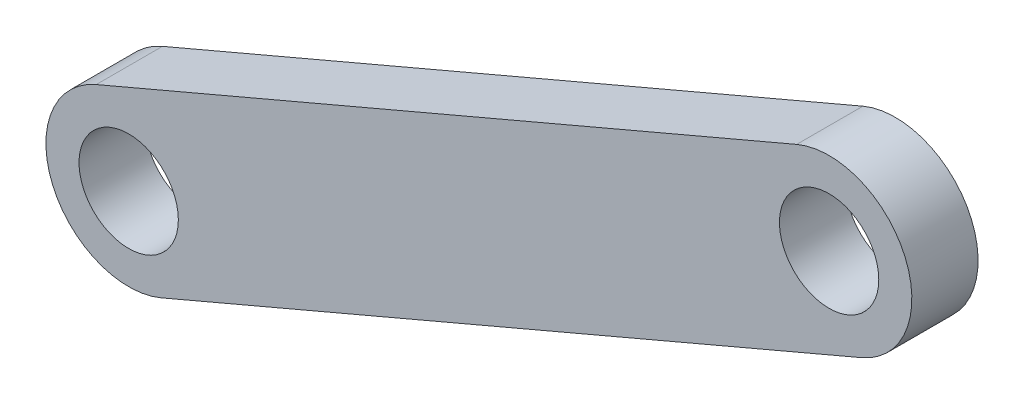
from build123d import *

# Parameters (mm, degrees)
BOSS_EXTRU_1_START      = -4
BOSS_EXTRU_1_DEPTH      = 2
ESQUISSE2_R             = 1.5
ENL_V_MAT_EXTRU_1_DEPTH = 2


with BuildPart() as part:
    # Esquisse1 → Boss.-Extru.1 (new body)
    with BuildSketch(Plane.XY.offset(BOSS_EXTRU_1_START)):
        with BuildLine():
            Line((-20.180030535, -16.314431829), (0.97983118, -7.299984969))
            ThreePointArc((0.97983118, -7.299984969), (2.40785155, -4.327503968), (-0.353745657, -2.52515374))
            ThreePointArc((-0.353745657, -2.52515374), (-0.672496032, -2.59214845), (-0.97983118, -2.700015031))
            Line((-0.97983118, -2.700015031), (-6.059542219, -4.86405494))
            Line((-6.059542219, -4.86405494), (-22.139692896, -11.714461891))
            ThreePointArc((-22.139692896, -11.714461891), (-23.459846684, -14.994278041), (-20.180030535, -16.314431829))
        make_face()
    extrude(amount=BOSS_EXTRU_1_DEPTH)

    # Esquisse2 → Enlèv. mat.-Extru.1 (cut)
    with BuildSketch(Plane.XY.offset(-2)):
        with Locations((-21.159861715, -14.01444686)):
            Circle(ESQUISSE2_R)
        with Locations((0, -5)):
            Circle(ESQUISSE2_R)
    extrude(amount=-ENL_V_MAT_EXTRU_1_DEPTH, mode=Mode.SUBTRACT)


solid = part.part
